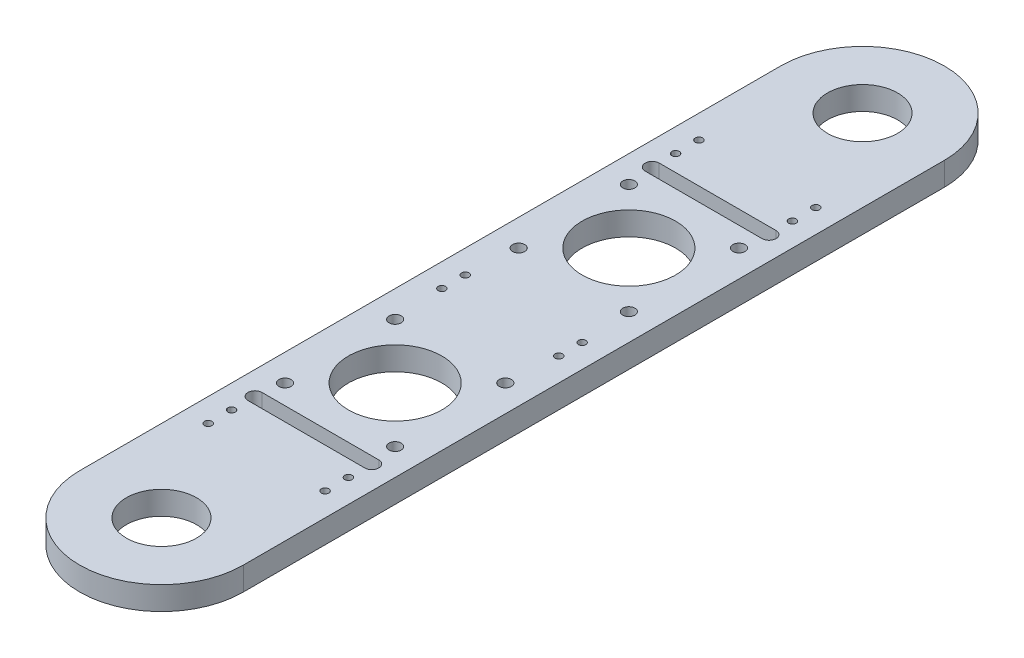
from build123d import *

# Parameters (mm, degrees)
SKETCH1_R               = 15
BOSS_EXTRUDE1_DEPTH     = 10
CUT_EXTRUDE1_DEPTH      = 189.54707635
CUT_EXTRUDE1_DEPTH_BACK = 189.54707635
SKETCH2_R               = 1.6
SKETCH4_R               = 20
SKETCH4_R_2             = 2.6
CUT_EXTRUDE3_DEPTH      = 189.54707635


with BuildPart() as part:
    # Sketch1 → Boss-Extrude1 (new body)
    with BuildSketch(Plane(origin=(0, 0, 0), x_dir=(1, 0, 0), z_dir=(0, 1, 0))):
        with BuildLine():
            Line((35, 150), (35, -150))
            ThreePointArc((35, -150), (0, -185), (-35, -150))
            Line((-35, -150), (-35, 150))
            ThreePointArc((-35, 150), (0, 185), (35, 150))
        make_face()
        with Locations(Location((0, -150, 0), (0, 0, 270))):
            Circle(SKETCH1_R, mode=Mode.SUBTRACT)
        with Locations(Location((0, 150, 0), (0, 0, 270))):
            Circle(SKETCH1_R, mode=Mode.SUBTRACT)
    extrude(amount=BOSS_EXTRUDE1_DEPTH)

    # Sketch2 → Cut-Extrude1 (cut, two sides: drawn at the far end of the back side and taken through both)
    with BuildSketch(Plane(origin=(0, 10, 0), x_dir=(1, 0, 0), z_dir=(0, 1, 0)).offset(-CUT_EXTRUDE1_DEPTH_BACK)):
        with Locations(Location((-25, 5, 0), (0, 0, 270))):
            Circle(SKETCH2_R)
        with Locations(Location((-25, -5, 0), (0, 0, 270))):
            Circle(SKETCH2_R)
        with Locations(Location((25, -5, 0), (0, 0, 270))):
            Circle(SKETCH2_R)
        with Locations(Location((25, 5, 0), (0, 0, 270))):
            Circle(SKETCH2_R)
        with Locations(Location((25, 95, 0), (0, 0, 270))):
            Circle(SKETCH2_R)
        with Locations(Location((25, 105, 0), (0, 0, 270))):
            Circle(SKETCH2_R)
        with Locations(Location((-25, 105, 0), (0, 0, 270))):
            Circle(SKETCH2_R)
        with Locations(Location((-25, 95, 0), (0, 0, 270))):
            Circle(SKETCH2_R)
        with Locations(Location((-25, -95, 0), (0, 0, 270))):
            Circle(SKETCH2_R)
        with Locations(Location((-25, -105, 0), (0, 0, 270))):
            Circle(SKETCH2_R)
        with Locations(Location((25, -105, 0), (0, 0, 270))):
            Circle(SKETCH2_R)
        with Locations(Location((25, -95, 0), (0, 0, 270))):
            Circle(SKETCH2_R)
    extrude(amount=CUT_EXTRUDE1_DEPTH + CUT_EXTRUDE1_DEPTH_BACK, mode=Mode.SUBTRACT)

    # Sketch4 → Cut-Extrude3 (cut, through all)
    with BuildSketch(Plane.XZ):
        with Locations(Location((0, -50, 0), (0, 0, 270))):
            Circle(SKETCH4_R)
        with Locations(Location((-23.57, -26.43, 0), (0, 0, 270))):
            Circle(SKETCH4_R_2)
        with Locations(Location((23.57, -26.43, 0), (0, 0, 270))):
            Circle(SKETCH4_R_2)
        with Locations(Location((23.57, -73.57, 0), (0, 0, 270))):
            Circle(SKETCH4_R_2)
        with Locations(Location((-23.57, -73.57, 0), (0, 0, 270))):
            Circle(SKETCH4_R_2)
        with BuildLine():
            Line((-25, -82), (25, -82))
            ThreePointArc((25, -82), (28, -85), (25, -88))
            Line((25, -88), (-25, -88))
            ThreePointArc((-25, -88), (-28, -85), (-25, -82))
        make_face()
    cut_extrude3 = extrude(amount=-CUT_EXTRUDE3_DEPTH, mode=Mode.SUBTRACT)

    # Mirror1: Cut-Extrude3 across plane
    add(cut_extrude3.mirror(Plane.XY), mode=Mode.SUBTRACT)


solid = part.part
